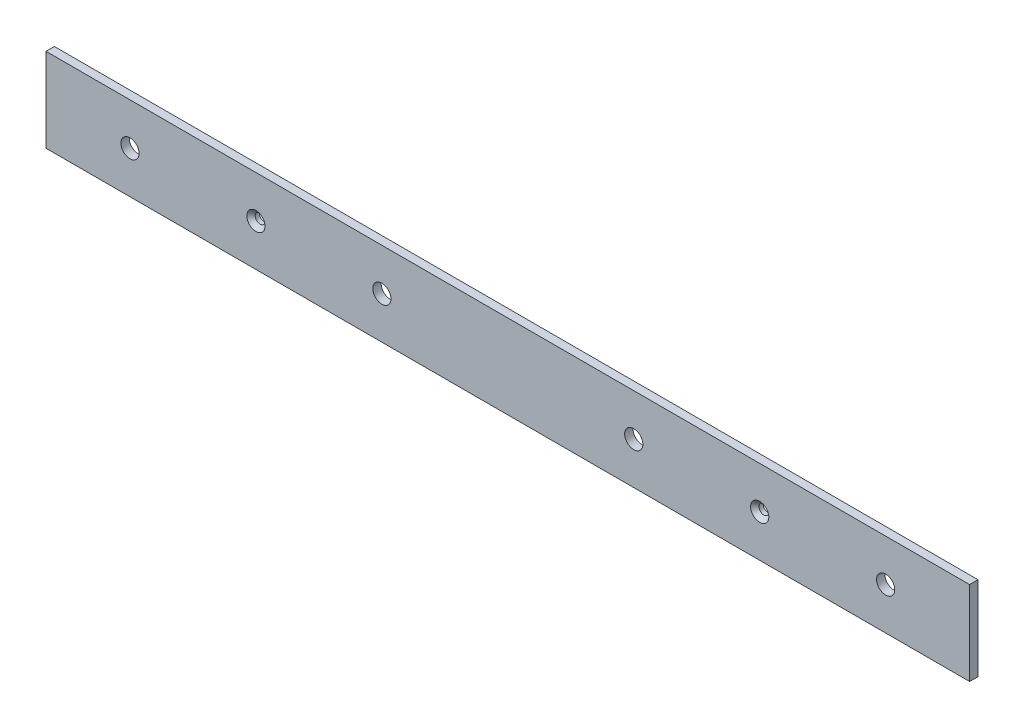
from build123d import *

# Parameters (mm, degrees)
SKETCH_1_W      = 330
SKETCH_1_H      = 30
SKETCH_1_R      = 3.25
SKETCH_1_R_2    = 1.75
EXTRUDE_1_DEPTH = 3
CHAMFER_1_SIZE  = 1.5


with BuildPart() as part:
    # Эскиз1 → Вытянуть1 (new body)
    with BuildSketch(Plane.XY):
        Rectangle(SKETCH_1_W, SKETCH_1_H)
        with Locations((135, 0)):
            Circle(SKETCH_1_R, mode=Mode.SUBTRACT)
        with Locations((90, 0)):
            Circle(SKETCH_1_R_2, mode=Mode.SUBTRACT)
        with Locations((45, 0)):
            Circle(SKETCH_1_R, mode=Mode.SUBTRACT)
        with Locations(Location((-45, 0, 0), (0, 0, 180))):
            Circle(SKETCH_1_R, mode=Mode.SUBTRACT)
        with Locations(Location((-90, 0, 0), (0, 0, 180))):
            Circle(SKETCH_1_R_2, mode=Mode.SUBTRACT)
        with Locations(Location((-135, 0, 0), (0, 0, 180))):
            Circle(SKETCH_1_R, mode=Mode.SUBTRACT)
    extrude(amount=EXTRUDE_1_DEPTH)

    # Фаска1
    chamfer_1_edges = [part.edges().sort_by_distance(p)[0] for p in [
        (88.25, 0, 3),
        (-88.25, 0, 3),
    ]]
    chamfer(chamfer_1_edges, length=CHAMFER_1_SIZE)


solid = part.part
